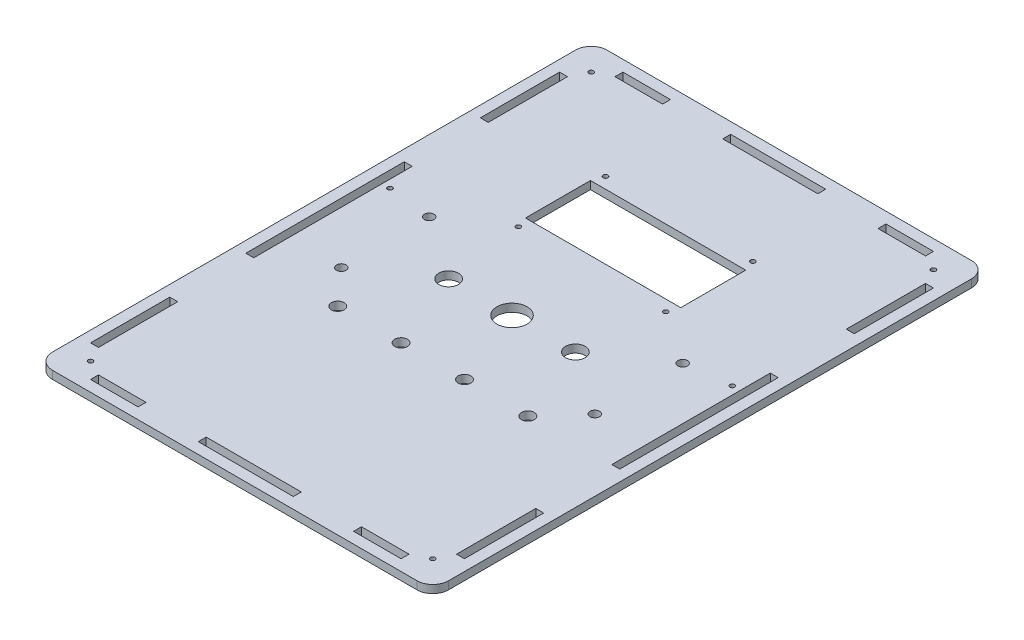
from build123d import *

# Parameters (mm, degrees)
SKETCH1_R           = 1.5
SKETCH1_W           = 30
SKETCH1_H           = 5
SKETCH1_W_2         = 5
SKETCH1_H_2         = 50
SKETCH1_R_2         = 3
SKETCH1_R_3         = 4
SKETCH1_W_3         = 60
SKETCH1_R_4         = 6.2
SKETCH1_R_5         = 9.5
SKETCH1_W_4         = 98
SKETCH1_H_3         = 41
SKETCH1_H_4         = 100
BOSS_EXTRUDE1_DEPTH = 5


with BuildPart() as part:
    # Sketch1 → Boss-Extrude1 (new body)
    # profile 1 of 2: a face of its own
    with BuildSketch(Plane(origin=(0, 0, 0), x_dir=(1, 0, 0), z_dir=(0, 1, 0))):
        with BuildLine():
            ThreePointArc((0, 10), (2.928932188, 2.928932188), (10, 0))
            Line((10, 0), (240, 0))
            ThreePointArc((240, 0), (247.071067812, 2.928932188), (250, 10))
            Line((250, 10), (250, 340))
            ThreePointArc((250, 340), (247.071067812, 347.071067812), (240, 350))
            Line((240, 350), (10, 350))
            ThreePointArc((10, 350), (2.928932188, 347.071067812), (0, 340))
            Line((0, 340), (0, 10))
        make_face()
        with Locations(Location((17, 17, 0), (0, 0, 270))):
            Circle(SKETCH1_R, mode=Mode.SUBTRACT)
        with Locations((42, 9.5)):
            Rectangle(SKETCH1_W, SKETCH1_H, mode=Mode.SUBTRACT)
        with Locations((9.5, 52)):
            Rectangle(SKETCH1_W_2, SKETCH1_H_2, mode=Mode.SUBTRACT)
        with Locations(Location((45, 147.266112644, 0), (0, 0, 270))):
            Circle(SKETCH1_R_2, mode=Mode.SUBTRACT)
        with Locations(Location((65, 125, 0), (0, 0, 270))):
            Circle(SKETCH1_R_3, mode=Mode.SUBTRACT)
        with Locations(Location((105, 125, 0), (0, 0, 270))):
            Circle(SKETCH1_R_3, mode=Mode.SUBTRACT)
        with Locations((125, 9.5)):
            Rectangle(SKETCH1_W_3, SKETCH1_H, mode=Mode.SUBTRACT)
        with Locations((208, 9.5)):
            Rectangle(SKETCH1_W, SKETCH1_H, mode=Mode.SUBTRACT)
        with Locations(Location((233, 17, 0), (0, 0, 270))):
            Circle(SKETCH1_R, mode=Mode.SUBTRACT)
        with Locations((240.5, 52)):
            Rectangle(SKETCH1_W_2, SKETCH1_H_2, mode=Mode.SUBTRACT)
        with Locations(Location((145, 125, 0), (0, 0, 270))):
            Circle(SKETCH1_R_3, mode=Mode.SUBTRACT)
        with Locations(Location((185, 125, 0), (0, 0, 270))):
            Circle(SKETCH1_R_3, mode=Mode.SUBTRACT)
        with Locations(Location((205, 147.266112644, 0), (0, 0, 270))):
            Circle(SKETCH1_R_2, mode=Mode.SUBTRACT)
        Polygon((7, 175), (7, 225), (12, 225), (12, 125), (7, 125), align=None, mode=Mode.SUBTRACT)
        with Locations(Location((17, 206, 0), (0, 0, 270))):
            Circle(SKETCH1_R, mode=Mode.SUBTRACT)
        with Locations(Location((45, 202.733887356, 0), (0, 0, 270))):
            Circle(SKETCH1_R_2, mode=Mode.SUBTRACT)
        with Locations(Location((85, 175, 0), (0, 0, 270))):
            Circle(SKETCH1_R_4, mode=Mode.SUBTRACT)
        with Locations(Location((78.5, 225.5, 0), (0, 0, 270))):
            Circle(SKETCH1_R, mode=Mode.SUBTRACT)
        with Locations((9.5, 298)):
            Rectangle(SKETCH1_W_2, SKETCH1_H_2, mode=Mode.SUBTRACT)
        with Locations(Location((17, 333, 0), (0, 0, 270))):
            Circle(SKETCH1_R, mode=Mode.SUBTRACT)
        with Locations((42, 340.5)):
            Rectangle(SKETCH1_W, SKETCH1_H, mode=Mode.SUBTRACT)
        with Locations(Location((78.5, 280.5, 0), (0, 0, 270))):
            Circle(SKETCH1_R, mode=Mode.SUBTRACT)
        with Locations(Location((125, 175, 0), (0, 0, 270))):
            Circle(SKETCH1_R_5, mode=Mode.SUBTRACT)
        with Locations(Location((165, 175, 0), (0, 0, 270))):
            Circle(SKETCH1_R_4, mode=Mode.SUBTRACT)
        with Locations((125, 253)):
            Rectangle(SKETCH1_W_4, SKETCH1_H_3, mode=Mode.SUBTRACT)
        with Locations(Location((171.5, 225.5, 0), (0, 0, 270))):
            Circle(SKETCH1_R, mode=Mode.SUBTRACT)
        with Locations(Location((205, 202.733887356, 0), (0, 0, 270))):
            Circle(SKETCH1_R_2, mode=Mode.SUBTRACT)
        with Locations((240.5, 175)):
            Rectangle(SKETCH1_W_2, SKETCH1_H_4, mode=Mode.SUBTRACT)
        with Locations(Location((233, 206, 0), (0, 0, 270))):
            Circle(SKETCH1_R, mode=Mode.SUBTRACT)
        with Locations(Location((171.5, 280.5, 0), (0, 0, 270))):
            Circle(SKETCH1_R, mode=Mode.SUBTRACT)
        Polygon((95, 343), (125, 343), (155, 343), (155, 338), (95, 338), align=None, mode=Mode.SUBTRACT)
        with Locations((240.5, 298)):
            Rectangle(SKETCH1_W_2, SKETCH1_H_2, mode=Mode.SUBTRACT)
        with Locations((208, 340.5)):
            Rectangle(SKETCH1_W, SKETCH1_H, mode=Mode.SUBTRACT)
        with Locations(Location((233, 333, 0), (0, 0, 270))):
            Circle(SKETCH1_R, mode=Mode.SUBTRACT)
    # profile 2 of 2: a face of its own
    with BuildSketch(Plane(origin=(0, 0, 0), x_dir=(1, 0, 0), z_dir=(0, 1, 0))):
        with BuildLine():
            ThreePointArc((0, 10), (2.928932188, 2.928932188), (10, 0))
            Line((10, 0), (240, 0))
            ThreePointArc((240, 0), (247.071067812, 2.928932188), (250, 10))
            Line((250, 10), (250, 340))
            ThreePointArc((250, 340), (247.071067812, 347.071067812), (240, 350))
            Line((240, 350), (10, 350))
            ThreePointArc((10, 350), (2.928932188, 347.071067812), (0, 340))
            Line((0, 340), (0, 10))
        make_face()
        with Locations(Location((17, 17, 0), (0, 0, 270))):
            Circle(SKETCH1_R, mode=Mode.SUBTRACT)
        with Locations((42, 9.5)):
            Rectangle(SKETCH1_W, SKETCH1_H, mode=Mode.SUBTRACT)
        with Locations((9.5, 52)):
            Rectangle(SKETCH1_W_2, SKETCH1_H_2, mode=Mode.SUBTRACT)
        with Locations(Location((45, 147.266112644, 0), (0, 0, 270))):
            Circle(SKETCH1_R_2, mode=Mode.SUBTRACT)
        with Locations(Location((65, 125, 0), (0, 0, 270))):
            Circle(SKETCH1_R_3, mode=Mode.SUBTRACT)
        with Locations(Location((105, 125, 0), (0, 0, 270))):
            Circle(SKETCH1_R_3, mode=Mode.SUBTRACT)
        with Locations((125, 9.5)):
            Rectangle(SKETCH1_W_3, SKETCH1_H, mode=Mode.SUBTRACT)
        with Locations((208, 9.5)):
            Rectangle(SKETCH1_W, SKETCH1_H, mode=Mode.SUBTRACT)
        with Locations(Location((233, 17, 0), (0, 0, 270))):
            Circle(SKETCH1_R, mode=Mode.SUBTRACT)
        with Locations((240.5, 52)):
            Rectangle(SKETCH1_W_2, SKETCH1_H_2, mode=Mode.SUBTRACT)
        with Locations(Location((145, 125, 0), (0, 0, 270))):
            Circle(SKETCH1_R_3, mode=Mode.SUBTRACT)
        with Locations(Location((185, 125, 0), (0, 0, 270))):
            Circle(SKETCH1_R_3, mode=Mode.SUBTRACT)
        with Locations(Location((205, 147.266112644, 0), (0, 0, 270))):
            Circle(SKETCH1_R_2, mode=Mode.SUBTRACT)
        Polygon((7, 175), (7, 225), (12, 225), (12, 125), (7, 125), align=None, mode=Mode.SUBTRACT)
        with Locations(Location((17, 206, 0), (0, 0, 270))):
            Circle(SKETCH1_R, mode=Mode.SUBTRACT)
        with Locations(Location((45, 202.733887356, 0), (0, 0, 270))):
            Circle(SKETCH1_R_2, mode=Mode.SUBTRACT)
        with Locations(Location((85, 175, 0), (0, 0, 270))):
            Circle(SKETCH1_R_4, mode=Mode.SUBTRACT)
        with Locations(Location((78.5, 225.5, 0), (0, 0, 270))):
            Circle(SKETCH1_R, mode=Mode.SUBTRACT)
        with Locations((9.5, 298)):
            Rectangle(SKETCH1_W_2, SKETCH1_H_2, mode=Mode.SUBTRACT)
        with Locations(Location((17, 333, 0), (0, 0, 270))):
            Circle(SKETCH1_R, mode=Mode.SUBTRACT)
        with Locations((42, 340.5)):
            Rectangle(SKETCH1_W, SKETCH1_H, mode=Mode.SUBTRACT)
        with Locations(Location((78.5, 280.5, 0), (0, 0, 270))):
            Circle(SKETCH1_R, mode=Mode.SUBTRACT)
        with Locations(Location((125, 175, 0), (0, 0, 270))):
            Circle(SKETCH1_R_5, mode=Mode.SUBTRACT)
        with Locations(Location((165, 175, 0), (0, 0, 270))):
            Circle(SKETCH1_R_4, mode=Mode.SUBTRACT)
        with Locations((125, 253)):
            Rectangle(SKETCH1_W_4, SKETCH1_H_3, mode=Mode.SUBTRACT)
        with Locations(Location((171.5, 225.5, 0), (0, 0, 270))):
            Circle(SKETCH1_R, mode=Mode.SUBTRACT)
        with Locations(Location((205, 202.733887356, 0), (0, 0, 270))):
            Circle(SKETCH1_R_2, mode=Mode.SUBTRACT)
        with Locations((240.5, 175)):
            Rectangle(SKETCH1_W_2, SKETCH1_H_4, mode=Mode.SUBTRACT)
        with Locations(Location((233, 206, 0), (0, 0, 270))):
            Circle(SKETCH1_R, mode=Mode.SUBTRACT)
        with Locations(Location((171.5, 280.5, 0), (0, 0, 270))):
            Circle(SKETCH1_R, mode=Mode.SUBTRACT)
        Polygon((95, 343), (125, 343), (155, 343), (155, 338), (95, 338), align=None, mode=Mode.SUBTRACT)
        with Locations((240.5, 298)):
            Rectangle(SKETCH1_W_2, SKETCH1_H_2, mode=Mode.SUBTRACT)
        with Locations((208, 340.5)):
            Rectangle(SKETCH1_W, SKETCH1_H, mode=Mode.SUBTRACT)
        with Locations(Location((233, 333, 0), (0, 0, 270))):
            Circle(SKETCH1_R, mode=Mode.SUBTRACT)
    extrude(amount=BOSS_EXTRUDE1_DEPTH)


solid = part.part
